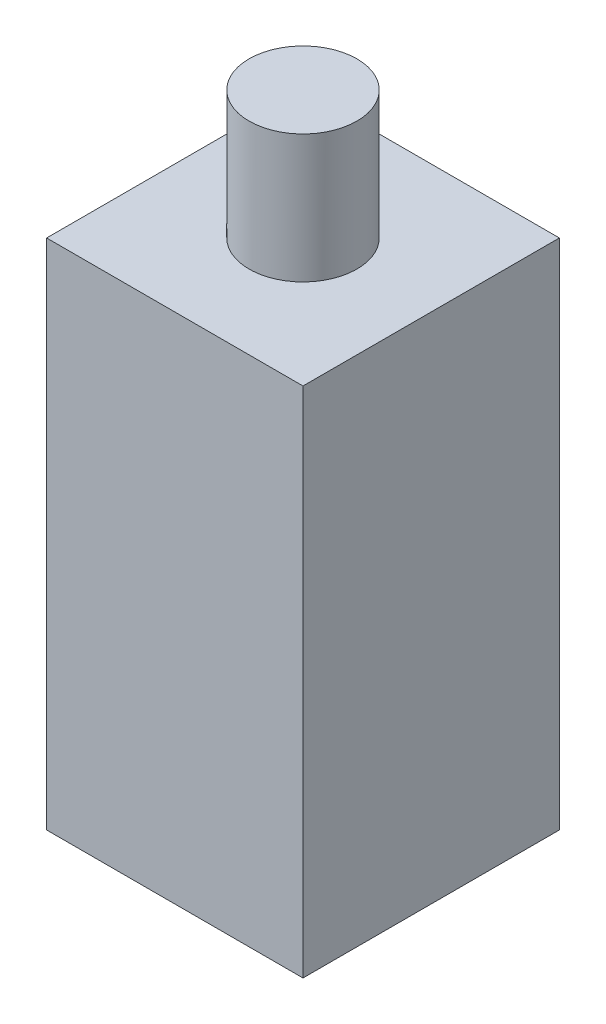
from build123d import *

# Parameters (mm, degrees)
SKETCH1_W           = 10
SKETCH1_H           = 10
BOSS_EXTRUDE1_DEPTH = 20
SKETCH2_R           = 2.103783414
BOSS_EXTRUDE2_DEPTH = 5


with BuildPart() as part:
    # Sketch1 → Boss-Extrude1 (new body)
    with BuildSketch(Plane(origin=(0, 0, 0), x_dir=(1, 0, 0), z_dir=(0, 1, 0))):
        Rectangle(SKETCH1_W, SKETCH1_H)
    extrude(amount=BOSS_EXTRUDE1_DEPTH)

    # Sketch2 → Boss-Extrude2 (add)
    with BuildSketch(Plane(origin=(0, 20, 0), x_dir=(1, 0, 0), z_dir=(0, 1, 0))):
        with Locations(Location((0, 0, 0), (0, 0, 90))):
            Circle(SKETCH2_R)
    extrude(amount=BOSS_EXTRUDE2_DEPTH)


solid = part.part
